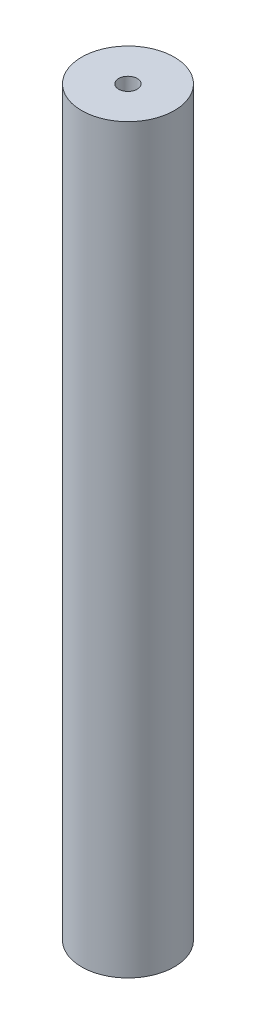
from build123d import *

# Parameters (mm, degrees)
SKETCH1_R                             = 12.7
BOSS_EXTRUDE1_DEPTH                   = 101.6
F_1_4_20_TAPPED_HOLE1_D               = 5.1054
F_1_4_20_TAPPED_HOLE1_DEPTH           = 16.51
F_1_4_20_TAPPED_HOLE1_TIP             = 1.533816902
F_1_4_20_TAPPED_HOLE1_ON_FACE_2_D     = 5.1054
F_1_4_20_TAPPED_HOLE1_ON_FACE_2_DEPTH = 16.51
F_1_4_20_TAPPED_HOLE1_ON_FACE_2_TIP   = 1.533816902


with BuildPart() as part:
    # Sketch1 → Boss-Extrude1 (new, symmetric)
    with BuildSketch(Plane(origin=(0, 0, 0), x_dir=(1, 0, 0), z_dir=(0, 1, 0))):
        with Locations(Location((0, 0, 0), (0, 0, 270))):
            Circle(SKETCH1_R)
    extrude(amount=BOSS_EXTRUDE1_DEPTH, both=True)

    # 1/4-20 Tapped Hole1
    with Locations(Plane.ZX.offset(101.6)):
        with Locations((0, 0)):
            Hole(F_1_4_20_TAPPED_HOLE1_D / 2, depth=F_1_4_20_TAPPED_HOLE1_DEPTH)
            with Locations((0, 0, -(F_1_4_20_TAPPED_HOLE1_DEPTH + F_1_4_20_TAPPED_HOLE1_TIP / 2))):  # 118° drill point
                Cone(0, F_1_4_20_TAPPED_HOLE1_D / 2, F_1_4_20_TAPPED_HOLE1_TIP, mode=Mode.SUBTRACT)

    # 1/4-20 Tapped Hole1 on face 2
    with Locations(Plane(origin=(0, -101.6, 0), x_dir=(0, 0, -1), z_dir=(0, -1, 0))):
        with Locations((0, 0)):
            Hole(F_1_4_20_TAPPED_HOLE1_ON_FACE_2_D / 2, depth=F_1_4_20_TAPPED_HOLE1_ON_FACE_2_DEPTH)
            with Locations((0, 0, -(F_1_4_20_TAPPED_HOLE1_ON_FACE_2_DEPTH + F_1_4_20_TAPPED_HOLE1_ON_FACE_2_TIP / 2))):  # 118° drill point
                Cone(0, F_1_4_20_TAPPED_HOLE1_ON_FACE_2_D / 2, F_1_4_20_TAPPED_HOLE1_ON_FACE_2_TIP, mode=Mode.SUBTRACT)


solid = part.part
